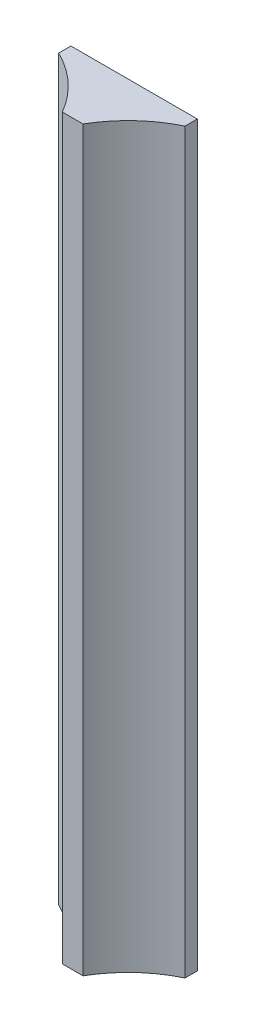
from build123d import *

# Parameters (mm, degrees)
BOSS_EXTRUDE1_DEPTH = 30


with BuildPart() as part:
    # Sketch1 → Boss-Extrude1 (new, symmetric)
    with BuildSketch(Plane(origin=(0, 0, 0), x_dir=(1, 0, 0), z_dir=(0, 1, 0))):
        with BuildLine():
            Line((-0.839745962, 0), (0.839745962, 0))
            ThreePointArc((0.839745962, 0), (2.690111154, 2.322937519), (5.141101056, 4))
            Line((5.141101056, 4), (5.141101056, 5))
            Line((5.141101056, 5), (-5.141101056, 5))
            Line((-5.141101056, 5), (-5.141101056, 4))
            ThreePointArc((-5.141101056, 4), (-2.690111154, 2.322937519), (-0.839745962, 0))
        make_face()
    extrude(amount=BOSS_EXTRUDE1_DEPTH, both=True)


solid = part.part
